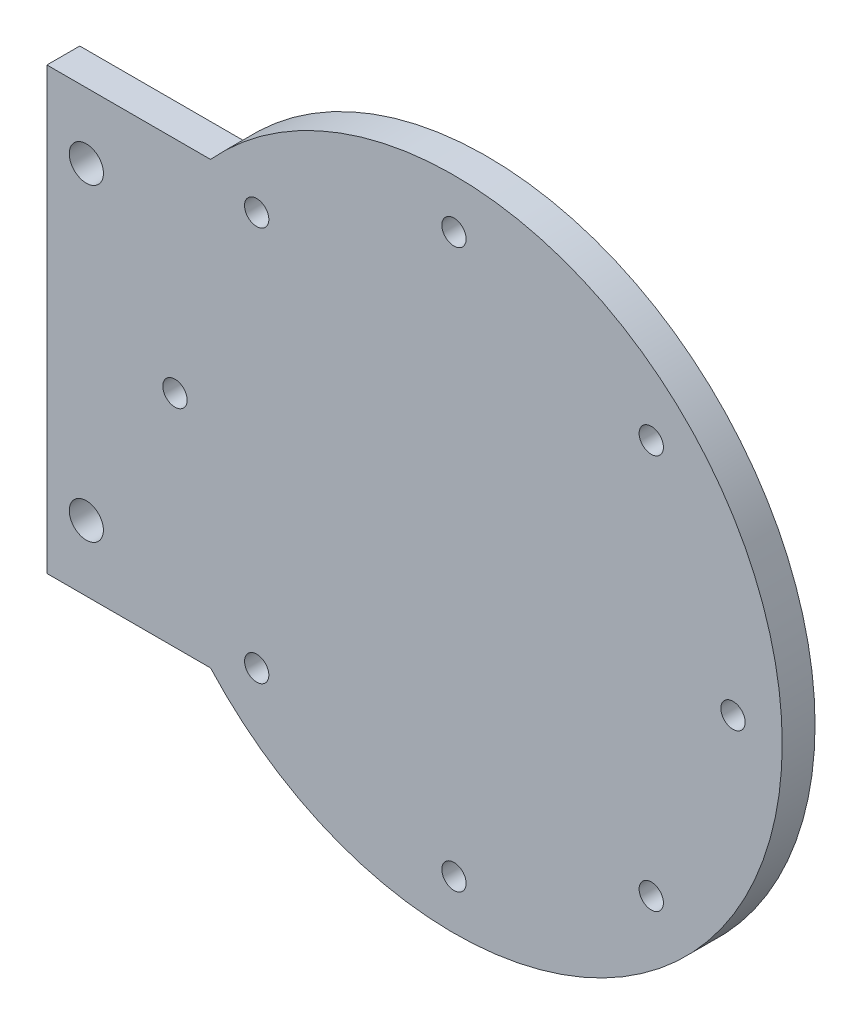
from build123d import *

# Parameters (mm, degrees)
SKETCH_1_R          = 2.6
EXTRUDE_1_DEPTH     = 5
SKETCH_2_R          = 1.85
CUT_EXTRUDE_1_DEPTH = 10


with BuildPart() as part:
    # 草图1 → 凸台-拉伸1 (new body)
    with BuildSketch(Plane.XY):
        with BuildLine():
            Line((-55.82167506, -33.808507072), (-30.902667496, -33.808507072))
            ThreePointArc((-30.902667496, -33.808507072), (56.17832494, -0.26748741), (-30.902667496, 33.273532253))
            Line((-30.902667496, 33.273532253), (-55.82167506, 33.273532253))
            Line((-55.82167506, 33.273532253), (-55.82167506, -33.808507072))
        make_face()
        with Locations((-49.82167506, -23.808507072)):
            Circle(SKETCH_1_R, mode=Mode.SUBTRACT)
        with Locations((-49.82167506, 23.273532253)):
            Circle(SKETCH_1_R, mode=Mode.SUBTRACT)
    extrude(amount=EXTRUDE_1_DEPTH)

    # 草图2 → 切除-拉伸1 (cut)
    with BuildSketch(Plane(origin=(0, 0, 0), x_dir=(-1, 0, 0), z_dir=(0, 0, -1))):
        with Locations((36.32167506, -0.26748741)):
            Circle(SKETCH_2_R)
        with Locations((23.873713261, -30.31952561)):
            Circle(SKETCH_2_R)
        with Locations((-6.17832494, -42.76748741)):
            Circle(SKETCH_2_R)
        with Locations((-36.23036314, -30.31952561)):
            Circle(SKETCH_2_R)
        with Locations((-48.67832494, -0.26748741)):
            Circle(SKETCH_2_R)
        with Locations((-36.23036314, 29.784550791)):
            Circle(SKETCH_2_R)
        with Locations((-6.17832494, 42.23251259)):
            Circle(SKETCH_2_R)
        with Locations((23.873713261, 29.784550791)):
            Circle(SKETCH_2_R)
    extrude(amount=-CUT_EXTRUDE_1_DEPTH, mode=Mode.SUBTRACT)


solid = part.part
